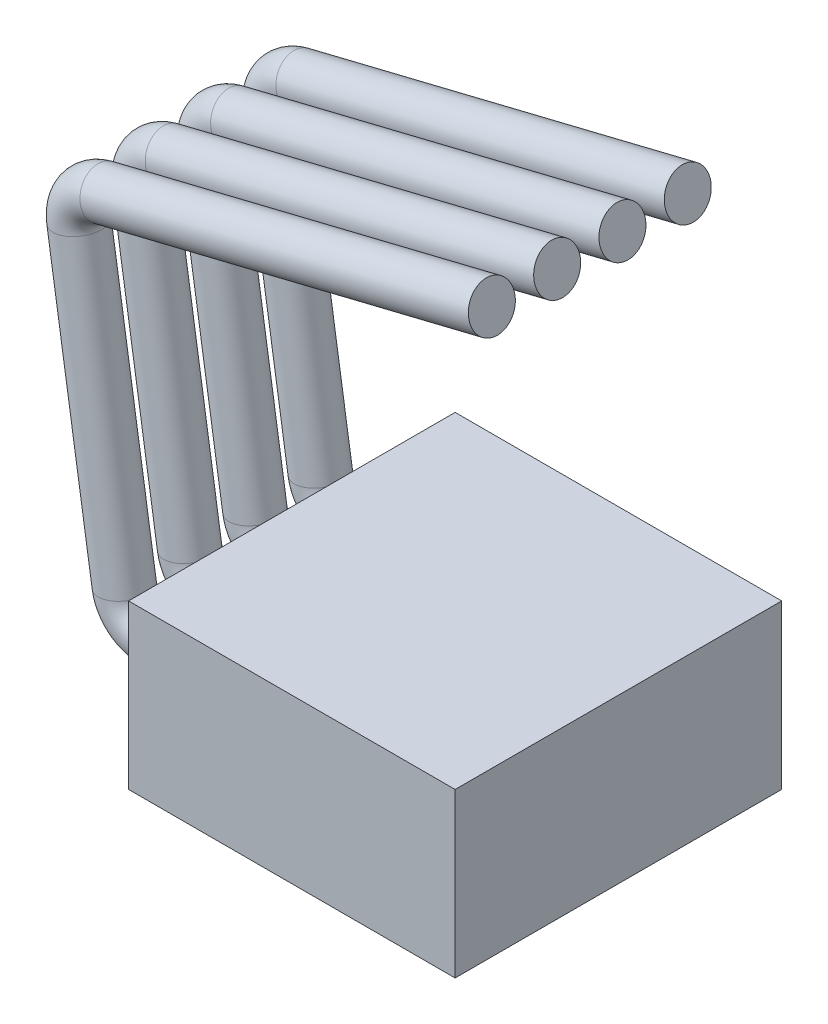
from build123d import *

# Parameters (mm, degrees)
SKETCH_1_W      = 5
SKETCH_1_H      = 5
EXTRUDE_1_DEPTH = 2.5
SKETCH_2_R      = 0.35


with BuildPart() as part:
    # Эскиз1 → Бобышка-Вытянуть1 (new body)
    with BuildSketch(Plane(origin=(0, 0, 0), x_dir=(1, 0, 0), z_dir=(0, 1, 0))):
        with Locations((-0.231814497, -1.280690723)):
            Rectangle(SKETCH_1_W, SKETCH_1_H)
    extrude(amount=EXTRUDE_1_DEPTH)

    # По траектории6: sweep along a path in Эскиз9
    with BuildLine(Plane.XY.offset(2.780690723)) as sweep_6_path:
        Line((-2.731814497, 1.25), (-3.303186974, 1.25))
        ThreePointArc((-3.303186974, 1.25), (-3.62860721, 1.370392743), (-3.797314507, 1.673593322))
        Line((-3.797314507, 1.673593322), (-4.491367464, 6.162084196))
        ThreePointArc((-4.491367464, 6.162084196), (-4.413168566, 6.515985685), (-4.11642191, 6.724078823))
        Line((-4.11642191, 6.724078823), (1.830230237, 8.183616228))
    # Эскиз2 → По траектории6 (sweep)
    with BuildSketch(Plane.ZY.offset(2.731814497)):
        with Locations((-0.219309277, 1.25)):
            Circle(SKETCH_2_R)
        with Locations((0.780690723, 1.25)):
            Circle(SKETCH_2_R)
        with Locations((1.780690723, 1.25)):
            Circle(SKETCH_2_R)
        with Locations((2.780690723, 1.25)):
            Circle(SKETCH_2_R)
    sweep(path=sweep_6_path.line)


solid = part.part
